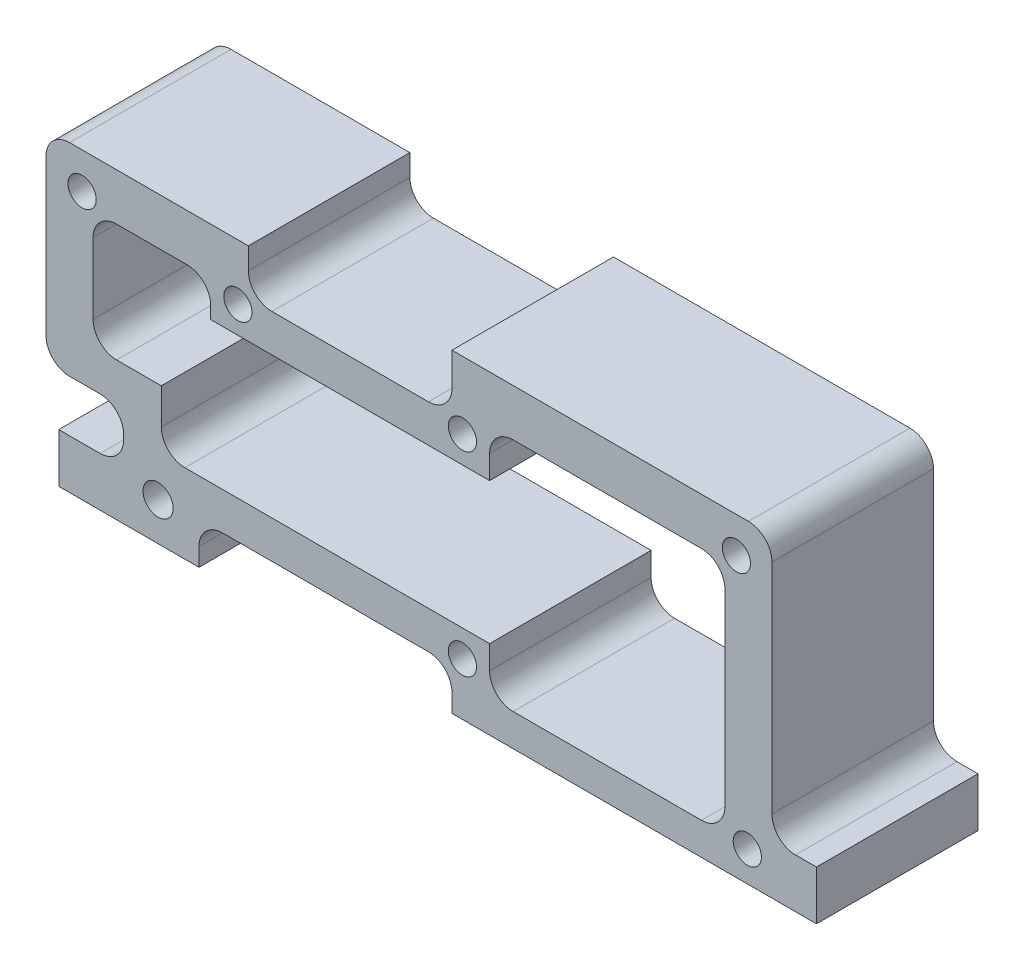
from build123d import *

# Parameters (mm, degrees)
SKETCH4_R      = 2.031992692
SKETCH4_R_2    = 1.905
EXTRUDE3_DEPTH = 10.8966


with BuildPart() as part:
    # Sketch4 → Extrude3 (new, symmetric)
    with BuildSketch(Plane.XY):
        with BuildLine():
            Line((-42.343481517, -2.990600597), (-42.343481517, 17.964399403))
            ThreePointArc((-42.343481517, 17.964399403), (-41.413545547, 20.209463433), (-39.168481517, 21.139399403))
            Line((-39.168481517, 21.139399403), (-15.038481517, 21.139399403))
            Line((-15.038481517, 21.139399403), (-15.038481517, 18.236569756))
            ThreePointArc((-15.038481517, 18.236569756), (-14.108545547, 15.991505726), (-11.863481517, 15.061569756))
            Line((-11.863481517, 15.061569756), (9.257081626, 15.061569756))
            ThreePointArc((9.257081626, 15.061569756), (11.502145656, 15.991505726), (12.432081626, 18.236569756))
            Line((12.432081626, 18.236569756), (12.432081626, 22.681569756))
            Line((12.432081626, 22.681569756), (52.437081626, 22.681569756))
            ThreePointArc((52.437081626, 22.681569756), (54.682145656, 21.751633786), (55.612081626, 19.506569756))
            Line((55.612081626, 19.506569756), (55.612081626, -9.945714332))
            ThreePointArc((55.612081626, -9.945714332), (56.542017596, -12.190778362), (58.787081626, -13.120714332))
            Line((58.787081626, -13.120714332), (61.618454053, -13.120714332))
            Line((61.618454053, -13.120714332), (61.618454053, -19.76149571))
            Line((61.618454053, -19.76149571), (12.432081626, -19.76149571))
            Line((12.432081626, -19.76149571), (12.432081626, -17.323430244))
            ThreePointArc((12.432081626, -17.323430244), (11.502145656, -15.078366214), (9.257081626, -14.148430244))
            Line((9.257081626, -14.148430244), (-18.530518374, -14.148430244))
            ThreePointArc((-18.530518374, -14.148430244), (-20.775582404, -15.078366214), (-21.705518374, -17.323430244))
            Line((-21.705518374, -17.323430244), (-21.705518374, -19.76149571))
            Line((-21.705518374, -19.76149571), (-40.618560355, -19.76149571))
            Line((-40.618560355, -19.76149571), (-40.618560355, -13.120714332))
            Line((-40.618560355, -13.120714332), (-35.040518374, -13.120714332))
            ThreePointArc((-35.040518374, -13.120714332), (-32.795454344, -12.190778362), (-31.865518374, -9.945714332))
            Line((-31.865518374, -9.945714332), (-31.865518374, -9.340600597))
            ThreePointArc((-31.865518374, -9.340600597), (-32.795454344, -7.095536567), (-35.040518374, -6.165600597))
            Line((-35.040518374, -6.165600597), (-39.168481517, -6.165600597))
            ThreePointArc((-39.168481517, -6.165600597), (-41.413545547, -5.235664628), (-42.343481517, -2.990600597))
        make_face()
        with Locations((-27.221195322, -14.622613425)):
            Circle(SKETCH4_R, mode=Mode.SUBTRACT)
        with Locations((52.287415303, -15.678066597)):
            Circle(SKETCH4_R_2, mode=Mode.SUBTRACT)
        with Locations((13.846294556, -12.683763681)):
            Circle(SKETCH4_R_2, mode=Mode.SUBTRACT)
        with Locations((13.846294556, 13.596903192)):
            Circle(SKETCH4_R_2, mode=Mode.SUBTRACT)
        with Locations((-37.474326825, 16.270244711)):
            Circle(SKETCH4_R_2, mode=Mode.SUBTRACT)
        with Locations((-16.452694446, 13.596903192)):
            Circle(SKETCH4_R_2, mode=Mode.SUBTRACT)
        with Locations((50.814973838, 17.884461968)):
            Circle(SKETCH4_R_2, mode=Mode.SUBTRACT)
        with BuildLine():
            Line((49.262081626, -12.243430244), (49.262081626, 13.156569756))
            ThreePointArc((49.262081626, 13.156569756), (48.332145656, 15.401633786), (46.087081626, 16.331569756))
            Line((46.087081626, 16.331569756), (20.687081626, 16.331569756))
            ThreePointArc((20.687081626, 16.331569756), (18.442017596, 15.401633786), (17.512081626, 13.156569756))
            Line((17.512081626, 13.156569756), (17.512081626, 9.981569756))
            Line((17.512081626, 9.981569756), (-20.118481517, 9.981569756))
            Line((-20.118481517, 9.981569756), (-20.118481517, 11.614399403))
            ThreePointArc((-20.118481517, 11.614399403), (-21.048417487, 13.859463433), (-23.293481517, 14.789399403))
            Line((-23.293481517, 14.789399403), (-32.818481517, 14.789399403))
            ThreePointArc((-32.818481517, 14.789399403), (-35.063545547, 13.859463433), (-35.993481517, 11.614399403))
            Line((-35.993481517, 11.614399403), (-35.993481517, 2.089399403))
            ThreePointArc((-35.993481517, 2.089399403), (-35.063545547, -0.155664628), (-32.818481517, -1.085600597))
            Line((-32.818481517, -1.085600597), (-26.785518374, -1.085600597))
            Line((-26.785518374, -1.085600597), (-26.785518374, -5.893430244))
            ThreePointArc((-26.785518374, -5.893430244), (-25.855582404, -8.138494274), (-23.610518374, -9.068430244))
            Line((-23.610518374, -9.068430244), (17.512081626, -9.068430244))
            Line((17.512081626, -9.068430244), (17.512081626, -12.243430244))
            ThreePointArc((17.512081626, -12.243430244), (18.442017596, -14.488494274), (20.687081626, -15.418430244))
            Line((20.687081626, -15.418430244), (46.087081626, -15.418430244))
            ThreePointArc((46.087081626, -15.418430244), (48.332145656, -14.488494274), (49.262081626, -12.243430244))
        make_face(mode=Mode.SUBTRACT)
    extrude(amount=EXTRUDE3_DEPTH, both=True)


solid = part.part
